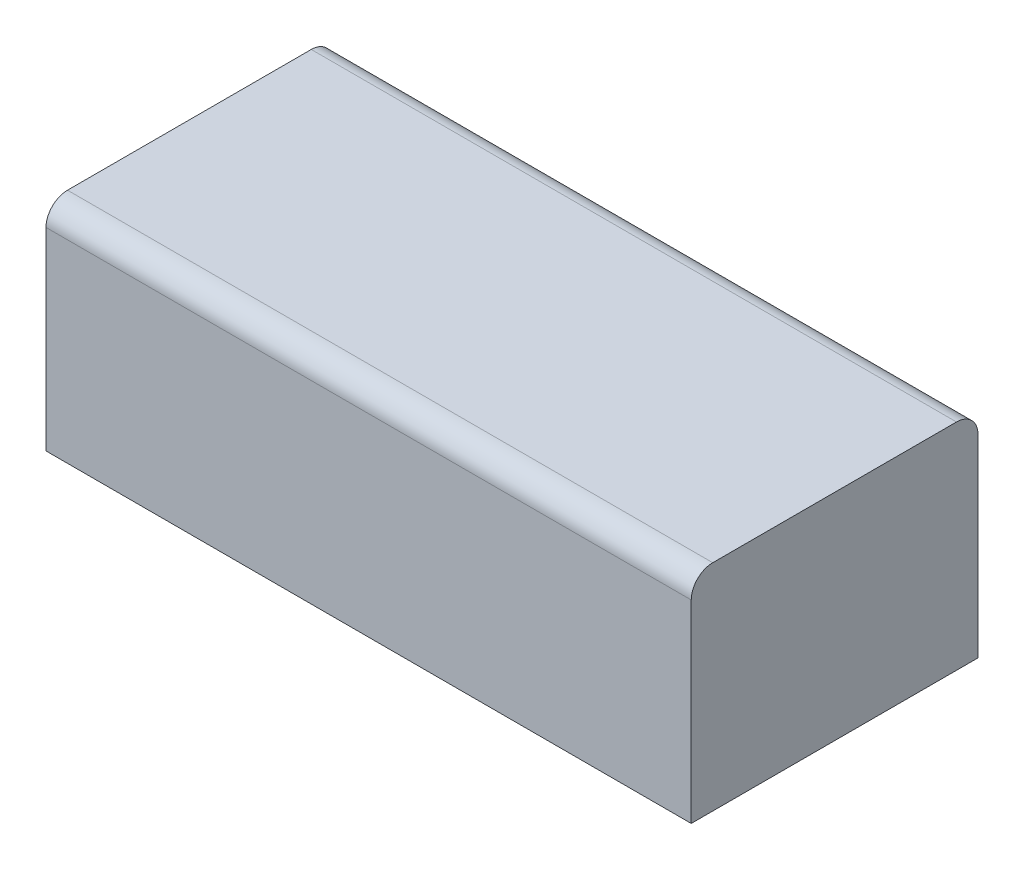
from build123d import *

# Parameters (mm, degrees)
SKETCH1_W           = 90
SKETCH1_H           = 40
BOSS_EXTRUDE1_DEPTH = 30
FILLET1_R           = 3
FILLET2_R           = 3


with BuildPart() as part:
    # Sketch1 → Boss-Extrude1 (new body)
    with BuildSketch(Plane(origin=(0, 0, 0), x_dir=(1, 0, 0), z_dir=(0, 1, 0))):
        with Locations((45, 20)):
            Rectangle(SKETCH1_W, SKETCH1_H)
    extrude(amount=BOSS_EXTRUDE1_DEPTH)

    # Fillet1
    fillet1_edges = [part.edges().sort_by_distance(p)[0] for p in [
        (45, 30, 0),
    ]]
    fillet(fillet1_edges, radius=FILLET1_R)

    # Fillet2
    fillet2_edges = [part.edges().sort_by_distance(p)[0] for p in [
        (45, 30, -40),
    ]]
    fillet(fillet2_edges, radius=FILLET2_R)


solid = part.part
